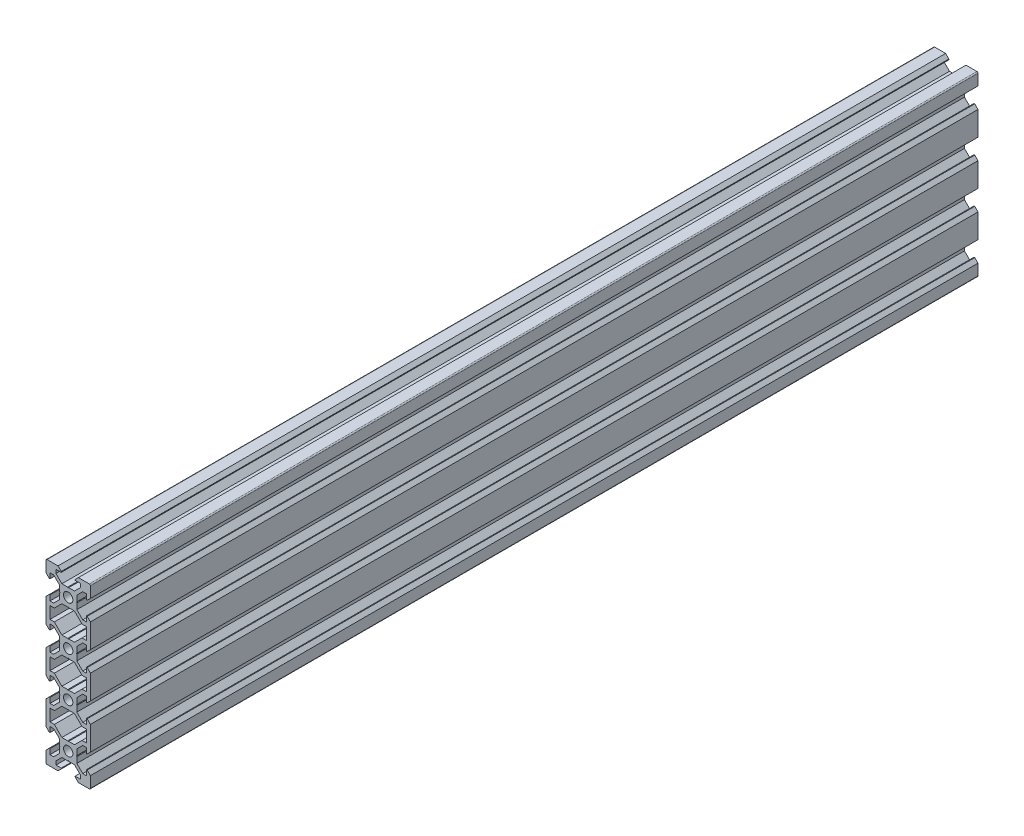
from build123d import *

# Parameters (mm, degrees)
BOSS_EXTRU_1_DEPTH = 400


with BuildPart() as part:
    # Esquisse1 → Boss.-Extru.1 (new body)
    with BuildSketch(Plane.XY):
        with BuildLine():
            Line((-9.5, 10), (-4.58, 10))
            Line((-4.58, 10), (-3.125, 8.545))
            Line((-3.125, 8.545), (-3.125, 8.2))
            Line((-3.125, 8.2), (-5.5, 8.2))
            Line((-5.5, 8.2), (-5.5, 6.560660172))
            Line((-5.5, 6.560660172), (-2.839339828, 3.9))
            Line((-2.839339828, 3.9), (-0.21, 3.9))
            Line((-0.21, 3.9), (0, 3.69))
            Line((0, 3.69), (0, 2.1))
            ThreePointArc((0, 2.1), (-2.1, 0), (0, -2.1))
            Line((0, -2.1), (0, -3.69))
            Line((0, -3.69), (-0.21, -3.9))
            Line((-0.21, -3.9), (-2.839339828, -3.9))
            Line((-2.839339828, -3.9), (-6.239339828, -7.3))
            Line((-6.239339828, -7.3), (-8.2, -7.3))
            Line((-8.2, -7.3), (-8.2, -12.7))
            Line((-8.2, -12.7), (-6.239339828, -12.7))
            Line((-6.239339828, -12.7), (-2.839339828, -16.1))
            Line((-2.839339828, -16.1), (-0.21, -16.1))
            Line((-0.21, -16.1), (0, -16.31))
            Line((0, -16.31), (0, -17.9))
            ThreePointArc((0, -17.9), (-2.1, -20), (0, -22.1))
            Line((0, -22.1), (0, -23.69))
            Line((0, -23.69), (-0.21, -23.9))
            Line((-0.21, -23.9), (-2.839339828, -23.9))
            Line((-2.839339828, -23.9), (-6.239339828, -27.3))
            Line((-6.239339828, -27.3), (-8.2, -27.3))
            Line((-8.2, -27.3), (-8.2, -32.7))
            Line((-8.2, -32.7), (-6.239339828, -32.7))
            Line((-6.239339828, -32.7), (-2.839339828, -36.1))
            Line((-2.839339828, -36.1), (-0.21, -36.1))
            Line((-0.21, -36.1), (0, -36.31))
            Line((0, -36.31), (0, -37.9))
            ThreePointArc((0, -37.9), (-2.1, -40), (0, -42.1))
            Line((0, -42.1), (0, -43.69))
            Line((0, -43.69), (-0.21, -43.9))
            Line((-0.21, -43.9), (-2.839339828, -43.9))
            Line((-2.839339828, -43.9), (-6.239339828, -47.3))
            Line((-6.239339828, -47.3), (-8.2, -47.3))
            Line((-8.2, -47.3), (-8.2, -52.7))
            Line((-8.2, -52.7), (-6.239339828, -52.7))
            Line((-6.239339828, -52.7), (-2.839339828, -56.1))
            Line((-2.839339828, -56.1), (-0.21, -56.1))
            Line((-0.21, -56.1), (0, -56.31))
            Line((0, -56.31), (0, -57.9))
            ThreePointArc((0, -57.9), (-2.1, -60), (0, -62.1))
            Line((0, -62.1), (0, -63.69))
            Line((0, -63.69), (-0.21, -63.9))
            Line((-0.21, -63.9), (-2.839339828, -63.9))
            Line((-2.839339828, -63.9), (-5.5, -66.560660172))
            Line((-5.5, -66.560660172), (-5.5, -68.2))
            Line((-5.5, -68.2), (-3.125, -68.2))
            Line((-3.125, -68.2), (-3.125, -68.545))
            Line((-3.125, -68.545), (-4.58, -70))
            Line((-4.58, -70), (-9.5, -70))
            ThreePointArc((-9.5, -70), (-9.853553391, -69.853553391), (-10, -69.5))
            Line((-10, -69.5), (-10, -64.58))
            Line((-10, -64.58), (-8.545, -63.125))
            Line((-8.545, -63.125), (-8.2, -63.125))
            Line((-8.2, -63.125), (-8.2, -65.5))
            Line((-8.2, -65.5), (-6.560660172, -65.5))
            Line((-6.560660172, -65.5), (-3.9, -62.839339828))
            Line((-3.9, -62.839339828), (-3.9, -60.21))
            Line((-3.9, -60.21), (-3.69, -60))
            Line((-3.69, -60), (-3.9, -59.79))
            Line((-3.9, -59.79), (-3.9, -57.160660172))
            Line((-3.9, -57.160660172), (-6.560660172, -54.5))
            Line((-6.560660172, -54.5), (-8.2, -54.5))
            Line((-8.2, -54.5), (-8.2, -56.875))
            Line((-8.2, -56.875), (-8.545, -56.875))
            Line((-8.545, -56.875), (-10, -55.42))
            Line((-10, -55.42), (-10, -44.58))
            Line((-10, -44.58), (-8.545, -43.125))
            Line((-8.545, -43.125), (-8.2, -43.125))
            Line((-8.2, -43.125), (-8.2, -45.5))
            Line((-8.2, -45.5), (-6.560660172, -45.5))
            Line((-6.560660172, -45.5), (-3.9, -42.839339828))
            Line((-3.9, -42.839339828), (-3.9, -40.21))
            Line((-3.9, -40.21), (-3.69, -40))
            Line((-3.69, -40), (-3.9, -39.79))
            Line((-3.9, -39.79), (-3.9, -37.160660172))
            Line((-3.9, -37.160660172), (-6.560660172, -34.5))
            Line((-6.560660172, -34.5), (-8.2, -34.5))
            Line((-8.2, -34.5), (-8.2, -36.875))
            Line((-8.2, -36.875), (-8.545, -36.875))
            Line((-8.545, -36.875), (-10, -35.42))
            Line((-10, -35.42), (-10, -24.58))
            Line((-10, -24.58), (-8.545, -23.125))
            Line((-8.545, -23.125), (-8.2, -23.125))
            Line((-8.2, -23.125), (-8.2, -25.5))
            Line((-8.2, -25.5), (-6.560660172, -25.5))
            Line((-6.560660172, -25.5), (-3.9, -22.839339828))
            Line((-3.9, -22.839339828), (-3.9, -20.21))
            Line((-3.9, -20.21), (-3.69, -20))
            Line((-3.69, -20), (-3.9, -19.79))
            Line((-3.9, -19.79), (-3.9, -17.160660172))
            Line((-3.9, -17.160660172), (-6.560660172, -14.5))
            Line((-6.560660172, -14.5), (-8.2, -14.5))
            Line((-8.2, -14.5), (-8.2, -16.875))
            Line((-8.2, -16.875), (-8.545, -16.875))
            Line((-8.545, -16.875), (-10, -15.42))
            Line((-10, -15.42), (-10, -4.58))
            Line((-10, -4.58), (-8.545, -3.125))
            Line((-8.545, -3.125), (-8.2, -3.125))
            Line((-8.2, -3.125), (-8.2, -5.5))
            Line((-8.2, -5.5), (-6.560660172, -5.5))
            Line((-6.560660172, -5.5), (-3.9, -2.839339828))
            Line((-3.9, -2.839339828), (-3.9, -0.21))
            Line((-3.9, -0.21), (-3.69, 0))
            Line((-3.69, 0), (-3.9, 0.21))
            Line((-3.9, 0.21), (-3.9, 2.839339828))
            Line((-3.9, 2.839339828), (-6.560660172, 5.5))
            Line((-6.560660172, 5.5), (-8.2, 5.5))
            Line((-8.2, 5.5), (-8.2, 3.125))
            Line((-8.2, 3.125), (-8.545, 3.125))
            Line((-8.545, 3.125), (-10, 4.58))
            Line((-10, 4.58), (-10, 9.5))
            ThreePointArc((-10, 9.5), (-9.853553391, 9.853553391), (-9.5, 10))
        make_face()
    boss_extru_1 = extrude(amount=BOSS_EXTRU_1_DEPTH)

    # Symétrie1: Boss.-Extru.1 across plane
    add(boss_extru_1.mirror(Plane(origin=(0, 3.69, 400), x_dir=(0, 0, 1), z_dir=(-1, 0, 0))))


solid = part.part
